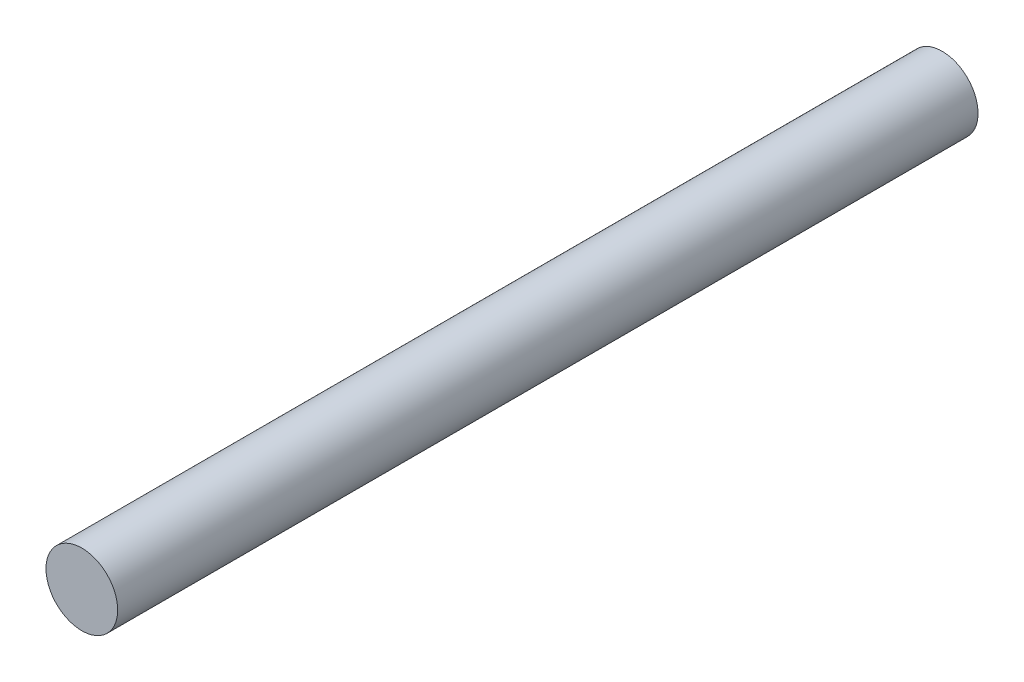
from build123d import *

# Parameters (mm, degrees)
SKETCH1_R           = 12.7
BOSS_EXTRUDE1_DEPTH = 304.8


with BuildPart() as part:
    # Sketch1 → Boss-Extrude1 (new body)
    with BuildSketch(Plane.XY):
        with Locations(Location((0, 0, 0), (0, 0, 180))):
            Circle(SKETCH1_R)
    extrude(amount=BOSS_EXTRUDE1_DEPTH)


solid = part.part
